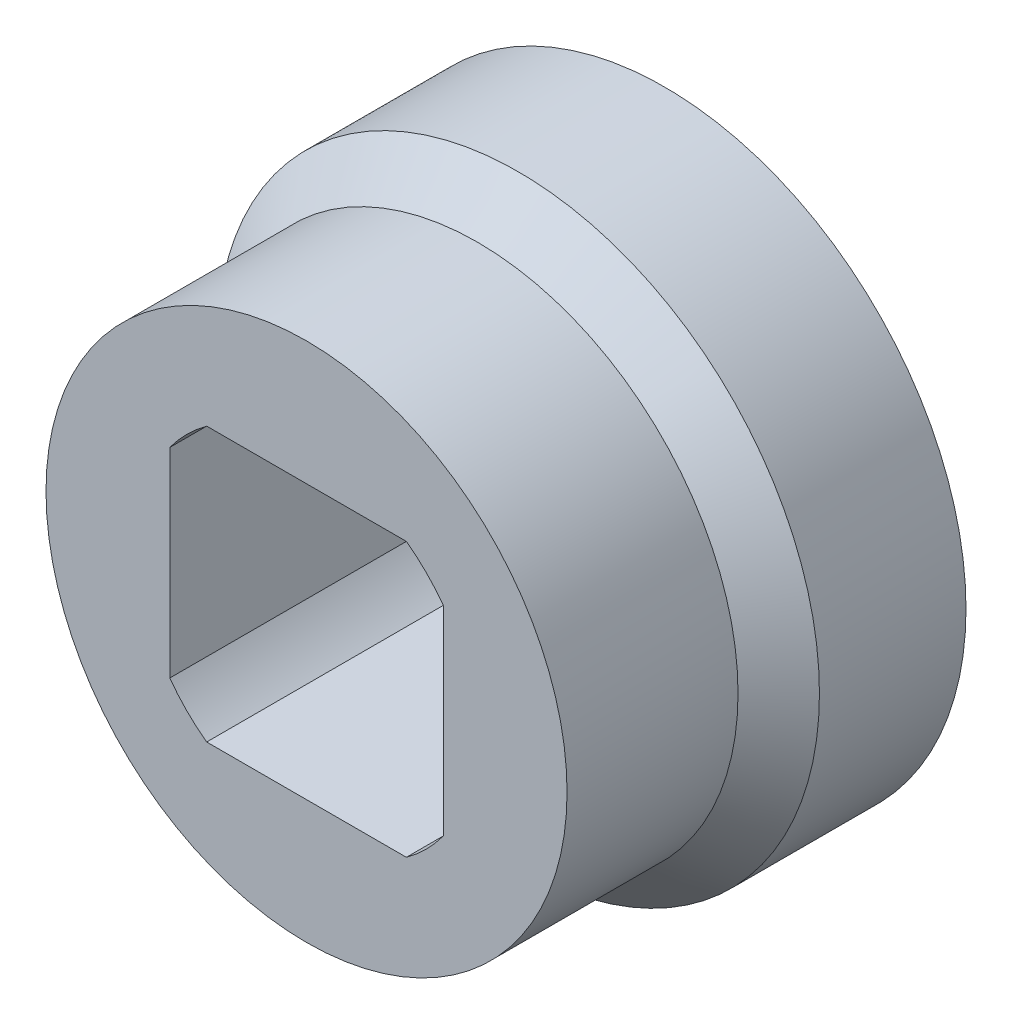
from build123d import *

# Parameters (mm, degrees)
TAGLIO_ESTRUSIONE1_DEPTH = 35.18332927
SCHIZZO3_W               = 16.3
SCHIZZO3_H               = 2
FORO_4_0_4_1_D           = 4.00000006
FORO_4_0_4_1_DEPTH       = 8


with BuildPart() as part:
    # Schizzo1 → Rivoluzione1 (revolve)
    with BuildSketch(Plane.XZ, mode=Mode.PRIVATE) as rivoluzione1_sk:
        Polygon((16, -3.5), (0, -3.5), (0, -25.5), (18.5, -25.5), (18.5, -16.5), (16, -14), align=None)
    revolve(rivoluzione1_sk.sketch.rotate(Axis((0, 0, -3.5), (0, 0, -1)), 180), axis=Axis((0, 0, -3.5), (0, 0, -1)))

    # Schizzo2 → Taglio-Estrusione1 (cut, through all)
    with BuildSketch(Plane(origin=(0, 0, -25.5), x_dir=(-1, 0, 0), z_dir=(0, 0, -1))):
        with BuildLine():
            Line((8.4, -6.131883887), (8.4, 6.131883887))
            ThreePointArc((8.4, 6.131883887), (7.353910524, 7.353910524), (6.131883887, 8.4))
            Line((6.131883887, 8.4), (-6.131883887, 8.4))
            ThreePointArc((-6.131883887, 8.4), (-7.353910524, 7.353910524), (-8.4, 6.131883887))
            Line((-8.4, 6.131883887), (-8.4, -6.131883887))
            ThreePointArc((-8.4, -6.131883887), (-7.353910524, -7.353910524), (-6.131883887, -8.4))
            Line((-6.131883887, -8.4), (6.131883887, -8.4))
            ThreePointArc((6.131883887, -8.4), (7.353910524, -7.353910524), (8.4, -6.131883887))
        make_face()
    extrude(amount=-TAGLIO_ESTRUSIONE1_DEPTH, mode=Mode.SUBTRACT)

    # Schizzo3 → Taglia-Rivoluzione1 (revolve, cut)
    with BuildSketch(Plane(origin=(0, 0, 0), x_dir=(1, 0, 0), z_dir=(0, 1, 0))):
        with Locations((8.15, 24.5)):
            Rectangle(SCHIZZO3_W, SCHIZZO3_H)
    revolve(axis=Axis((0, 0, -25.5), (0, 0, 1)), mode=Mode.SUBTRACT)

    # Foro Ø4.0 (4)-1
    with Locations(Plane(origin=(0, 0, -23.5), x_dir=(-1, 0, 0), z_dir=(0, 0, -1))):
        with Locations((-12, 0), (0, -12), (12, 0), (0, 12)):
            Hole(FORO_4_0_4_1_D / 2, depth=FORO_4_0_4_1_DEPTH)


solid = part.part
